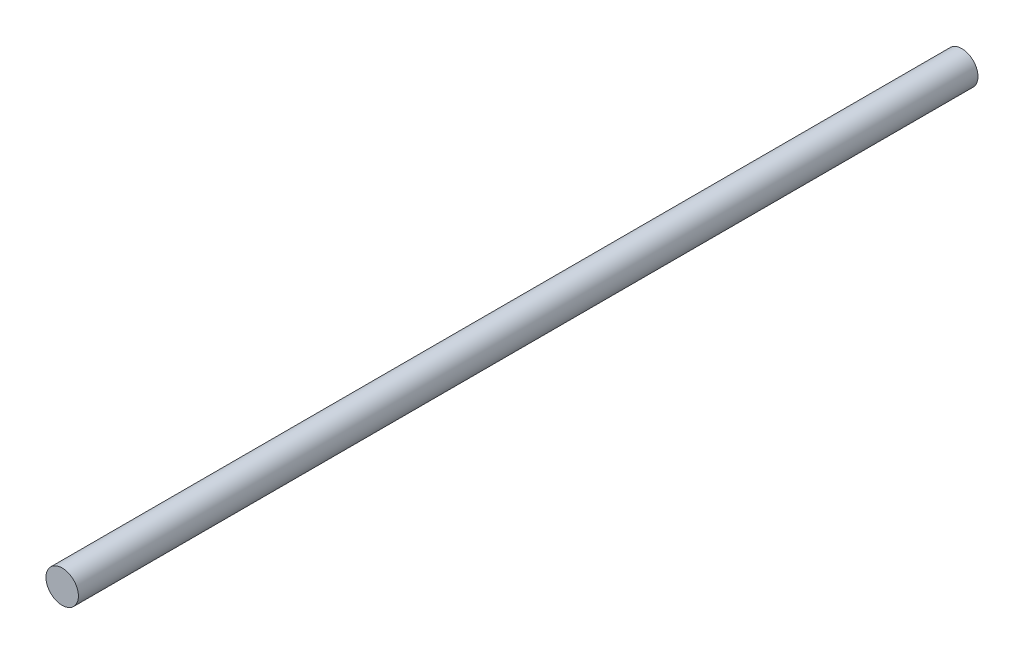
from build123d import *

# Parameters (mm, degrees)
SKETCH1_R = 4
ROD_DEPTH = 222


with BuildPart() as part:
    # Sketch1 → Rod (new body)
    with BuildSketch(Plane.XY):
        Circle(SKETCH1_R)
    extrude(amount=ROD_DEPTH)


solid = part.part
